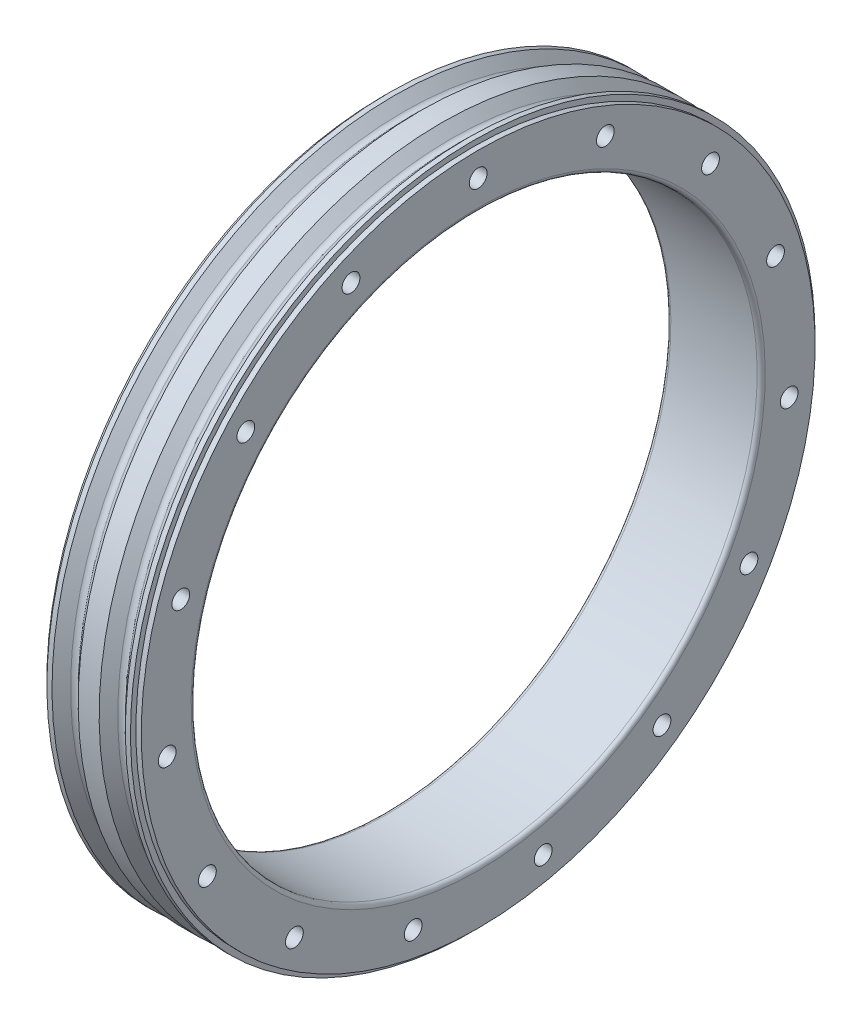
from build123d import *

# Parameters (mm, degrees)
FILLET1_R                               = 2
CBORE_FOR_M6_HEX_HEAD_BOLT1_D           = 6.6
CBORE_FOR_M6_HEX_HEAD_BOLT1_CBORE_D     = 14.547
CBORE_FOR_M6_HEX_HEAD_BOLT1_CBORE_DEPTH = 4
CIRPATTERN1_COUNT                       = 15
CUT_EXTRUDE2_START                      = -2
SKETCH7_R                               = 127
SKETCH7_R_2                             = 125
CUT_EXTRUDE2_DEPTH                      = 2
FILLET2_R                               = 1.5


with BuildPart() as part:
    # Sketch2 → Revolve1 (revolve)
    with BuildSketch(Plane.XY):
        Polygon((17.5, 105), (17.5, 127), (13.613961031, 127), (8.75, 122.136038969), (3.886038969, 127), (-3.886038969, 127), (-8.75, 122.136038969), (-13.613961031, 127), (-17.5, 127), (-17.5, 105), align=None)
    revolve(axis=Axis((0, 0, 0), (-1, 0, 0)))

    # Fillet1
    fillet1_edges = [part.edges().sort_by_distance(p)[0] for p in [
        (-8.75, -122.136038969, 0),
        (8.75, -122.136038969, 0),
    ]]
    fillet(fillet1_edges, radius=FILLET1_R)

    # CBORE for M6 Hex Head Bolt1 (through all)
    with Locations(Plane(origin=(-17.5, 116, 0), x_dir=(0, -1, 0), z_dir=(-1, 0, 0))):
        with Locations((0, 0)):
            cbore_for_m6_hex_head_bolt1 = CounterBoreHole(CBORE_FOR_M6_HEX_HEAD_BOLT1_D / 2, CBORE_FOR_M6_HEX_HEAD_BOLT1_CBORE_D / 2, CBORE_FOR_M6_HEX_HEAD_BOLT1_CBORE_DEPTH)

    # CirPattern1: CBORE for M6 Hex Head Bolt1 ×15 about axis
    cirpattern1_axis = Axis((0, 0, 0), (1, 0, 0))
    for i in range(1, CIRPATTERN1_COUNT):
        add(cbore_for_m6_hex_head_bolt1.rotate(cirpattern1_axis, i * 360 / CIRPATTERN1_COUNT), mode=Mode.SUBTRACT)

    # Sketch7 → Cut-Extrude2 (cut)
    with BuildSketch(Plane(origin=(17.5, 0, 0), x_dir=(0, 0, -1), z_dir=(1, 0, 0)).offset(CUT_EXTRUDE2_START)):
        with Locations(Location((0, 0, 0), (0, 0, 90))):
            Circle(SKETCH7_R)
        with Locations(Location((0, 0, 0), (0, 0, 90))):
            Circle(SKETCH7_R_2, mode=Mode.SUBTRACT)
    cut_extrude2 = extrude(amount=CUT_EXTRUDE2_DEPTH, mode=Mode.SUBTRACT)

    # Mirror1: Cut-Extrude2 across plane
    add(cut_extrude2.mirror(Plane(origin=(0, 0, 0), x_dir=(0, 0, 1), z_dir=(1, 0, 0))), mode=Mode.SUBTRACT)

    # Fillet2
    fillet2_edges = [part.edges().sort_by_distance(p)[0] for p in [
        (-17.5, -105, 0),
        (17.5, -105, 0),
    ]]
    fillet(fillet2_edges, radius=FILLET2_R)


solid = part.part
